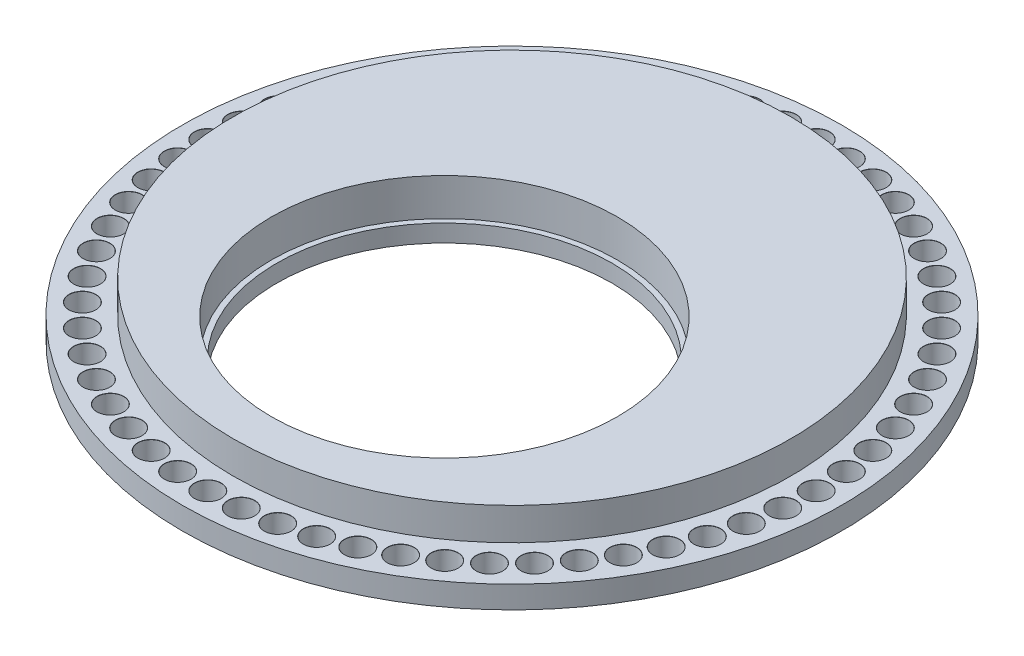
from build123d import *

# Parameters (mm, degrees)
SKETCH1_R                  = 61.9125
SKETCH1_R_2                = 30.988
SLOTTED_BODY_EXTRUDE_DEPTH = 4.191
SKETCH5_R                  = 52.3875
BOSS_EXTRUDE3_DEPTH        = 6.080000032
SKETCH6_R                  = 32.512
CUT_EXTRUDE5_DEPTH         = 89.157862691
SKETCH8_R                  = 32.512
SKETCH8_R_2                = 31.496
BOSS_EXTRUDE4_DEPTH        = 3.255000094
CIRPATTERN1_COUNT          = 60


with BuildPart() as part:
    # Sketch1 → Slotted-Body Extrude (new body)
    with BuildSketch(Plane(origin=(0, 0, 0), x_dir=(1, 0, 0), z_dir=(0, 1, 0))):
        with Locations(Location((0, 0, 0), (0, 0, 270))):
            Circle(SKETCH1_R)
        with Locations(Location((0, -12.7, 0), (0, 0, 270))):
            Circle(SKETCH1_R_2, mode=Mode.SUBTRACT)
    extrude(amount=SLOTTED_BODY_EXTRUDE_DEPTH)

    # Sketch5 → Boss-Extrude3 (add)
    with BuildSketch(Plane(origin=(0, 4.191, 0), x_dir=(1, 0, 0), z_dir=(0, 1, 0))):
        with Locations(Location((0, 0, 0), (0, 0, 270))):
            Circle(SKETCH5_R)
    extrude(amount=BOSS_EXTRUDE3_DEPTH)

    # Sketch6 → Cut-Extrude5 (cut, through all)
    with BuildSketch(Plane.XZ):
        with Locations(Location((0, 12.7, 0), (0, 0, 270))):
            Circle(SKETCH6_R)
    extrude(amount=-CUT_EXTRUDE5_DEPTH, mode=Mode.SUBTRACT)

    # Sketch10 → Ø5.0mm Dowel Hole1 (revolve, cut)
    with BuildSketch(Plane(origin=(0, 4.191, -57.15), x_dir=(0, 0, 1), z_dir=(1, 0, 0))):
        Polygon((0, 0), (0, 4.191), (2.5, 4.191), (2.5, 0.025), (2.525, 0), align=None)
    f_5_0mm_dowel_hole1 = revolve(axis=Axis((0, 10.541, -57.15), (0, -1, 0)), mode=Mode.SUBTRACT)

    # CirPattern1: Ø5.0mm Dowel Hole1 ×60 about axis
    cirpattern1_axis = Axis((0, 0, 0), (0, 1, 0))
    for i in range(1, CIRPATTERN1_COUNT):
        add(f_5_0mm_dowel_hole1.rotate(cirpattern1_axis, i * 360 / CIRPATTERN1_COUNT), mode=Mode.SUBTRACT)


with BuildPart() as body_2:
    # Sketch8 → Boss-Extrude4 (new body)
    with BuildSketch(Plane.XZ):
        with Locations(Location((0, 12.7, 0), (0, 0, 270))):
            Circle(SKETCH8_R)
        with Locations(Location((0, 12.7, 0), (0, 0, 270))):
            Circle(SKETCH8_R_2, mode=Mode.SUBTRACT)
    extrude(amount=-BOSS_EXTRUDE4_DEPTH)


solid = Compound([part.part, body_2.part])
